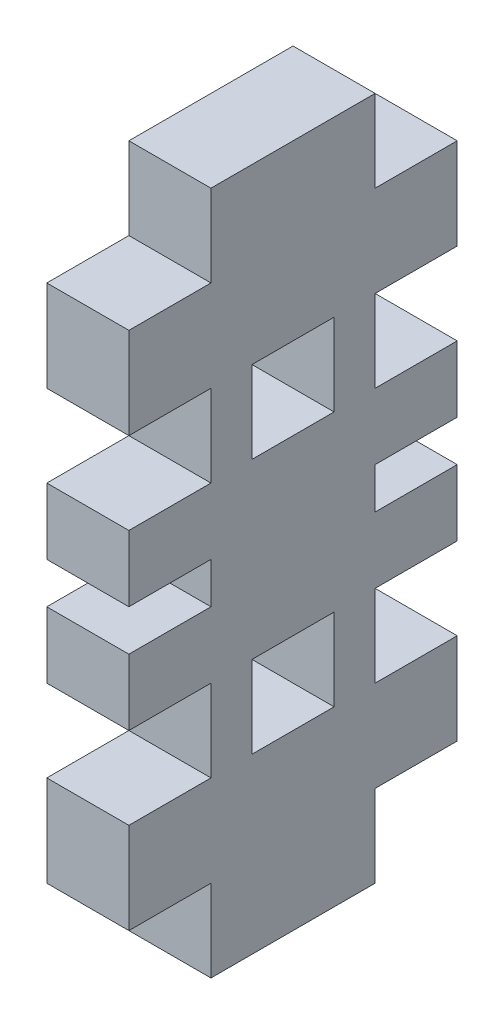
from build123d import *

# Parameters (mm, degrees)
SKETCH1_R                = 8
SKETCH1_R_2              = 4
BOSS_EXTRUDE1_DEPTH      = 9
BOSS_EXTRUDE1_2_DEPTH    = 9
SKETCH2_R                = 4
BOSS_EXTRUDE3_DEPTH      = 9
FILLET1_R                = 1
CUT_EXTRUDE1_DEPTH       = 214.789616212
SKETCH4_W                = 9
SKETCH4_H                = 27
BOSS_EXTRUDE4_DEPTH      = 75
BOSS_EXTRUDE5_START      = 9
SKETCH5_R                = 25
SKETCH5_R_2              = 4
BOSS_EXTRUDE5_DEPTH      = 9
BOSS_EXTRUDE6_DEPTH      = 4.5
BOSS_EXTRUDE6_DEPTH_BACK = 4.5
BOSS_EXTRUDE7_DEPTH      = 4.5
BOSS_EXTRUDE7_DEPTH_BACK = 4.5
BOSS_EXTRUDE7_START      = -25
SKETCH9_W                = 9
SKETCH9_H                = 7
SKETCH9_H_2              = 9
CUT_EXTRUDE2_DEPTH       = 217.612557346
CUT_EXTRUDE3_DEPTH       = 216.299790989
CUT_EXTRUDE3_DEPTH_BACK  = 216.299790989
SKETCH10_W               = 383.266903908
SKETCH10_H               = 66.559710411
SKETCH10_W_2             = 9
SKETCH10_H_2             = 36
SKETCH12_W               = 9
SKETCH12_H               = 9
SKETCH12_W_2             = 4.5
SKETCH12_H_2             = 9.054007778
SKETCH12_H_3             = 4.5
SKETCH12_H_4             = 5
CUT_EXTRUDE4_DEPTH       = 81.218451743


with BuildPart() as part:
    # Sketch1 → Boss-Extrude1 (new body)
    with BuildSketch(Plane.XY):
        with Locations((-125, 0)):
            Circle(SKETCH1_R)
        with Locations((-125, 0)):
            Circle(SKETCH1_R_2, mode=Mode.SUBTRACT)
    extrude(amount=BOSS_EXTRUDE1_DEPTH)



with BuildPart() as body_2:
    # Sketch1 → Boss-Extrude1 2 (new body)
    with BuildSketch(Plane.XY):
        with Locations((125, 0)):
            Circle(SKETCH1_R)
        with Locations((125, 0)):
            Circle(SKETCH1_R_2, mode=Mode.SUBTRACT)
    extrude(amount=BOSS_EXTRUDE1_2_DEPTH)


with BuildPart() as part_1:
    add(part.part)

    add(body_2.part)  # Boss-Extrude3 merges body 2
    # Sketch2 → Boss-Extrude3 (add)
    with BuildSketch(Plane.XY):
        with BuildLine():
            Line((-175, -75), (125, -75))
            ThreePointArc((125, -75), (130.131670325, -43.377223009), (145.000000492, -14.999999344))
            ThreePointArc((145.000000492, -14.999999344), (143.981414944, 16.269784471), (113.235294528, 22.058823748))
            ThreePointArc((113.235294528, 22.058823748), (25.000000075, 0), (-63.235294395, 22.058823677))
            ThreePointArc((-63.235294395, 22.058823677), (-75.420498385, 24.996463372), (-87.499999896, 21.650635154))
            ThreePointArc((-87.499999896, 21.650635154), (-99.999999954, 18.301270189), (-112.500000024, 21.650635108))
            ThreePointArc((-112.500000024, 21.650635108), (-124.99999995, 25), (-137.49999989, 21.650635158))
            ThreePointArc((-137.49999989, 21.650635158), (-149.999999954, 18.301270189), (-162.50000003, 21.650635112))
            ThreePointArc((-162.50000003, 21.650635112), (-193.705072901, 16.586749162), (-195.000000551, -14.999999265))
            ThreePointArc((-195.000000551, -14.999999265), (-180.13167034, -43.377222962), (-175, -75))
        make_face()
        with Locations((125, 0)):
            Circle(SKETCH2_R, mode=Mode.SUBTRACT)
        with Locations((-175, 0)):
            Circle(SKETCH2_R, mode=Mode.SUBTRACT)
        with Locations((-125, 0)):
            Circle(SKETCH2_R, mode=Mode.SUBTRACT)
        with Locations((-75, 0)):
            Circle(SKETCH2_R, mode=Mode.SUBTRACT)
    extrude(amount=BOSS_EXTRUDE3_DEPTH)

    # Fillet1
    fillet1_edges = [part_1.edges().sort_by_distance(p)[0] for p in [
        (-175, -75, 4.5),
        (125, -75, 4.5),
    ]]
    fillet(fillet1_edges, radius=FILLET1_R)

    # Sketch3 → Cut-Extrude1 (cut, through all)
    with BuildSketch(Plane.XY):
        Polygon((25, 0), (25, -75), (150, -75), (150, 25), (25, 25), align=None)
    extrude(amount=CUT_EXTRUDE1_DEPTH, mode=Mode.SUBTRACT)

    # Sketch4 → Boss-Extrude4 (add)
    with BuildSketch(Plane.XZ.offset(75)):
        with Locations((25, -4.5)):
            Rectangle(SKETCH4_W, SKETCH4_H)
    extrude(amount=-BOSS_EXTRUDE4_DEPTH)

    # Sketch5 → Boss-Extrude5 (add)
    # profile 1 of 4: a face of its own
    with BuildSketch(Plane(origin=(0, 0, -18), x_dir=(-1, 0, 0), z_dir=(0, 0, -1)).offset(BOSS_EXTRUDE5_START)):
        with BuildLine():
            ThreePointArc((-145.000000304, -14.999999594), (-130.131670275, -43.377223158), (-125, -75))
            Line((-125, -75), (-29.5, -75))
            Line((-29.5, -75), (-29.5, 0))
            Line((-29.5, 0), (-100, 0))
            ThreePointArc((-100, 0), (-117.09430609, -23.717082532), (-145.000000304, -14.999999594))
        make_face()
    # profile 2 of 4: a face of its own
    with BuildSketch(Plane(origin=(0, 0, -18), x_dir=(-1, 0, 0), z_dir=(0, 0, -1)).offset(BOSS_EXTRUDE5_START)):
        with Locations((-125, 0)):
            Circle(SKETCH5_R)
        with Locations((-125, 0)):
            Circle(SKETCH5_R_2, mode=Mode.SUBTRACT)
    # profile 3 of 4: a face of its own
    with BuildSketch(Plane(origin=(0, 0, -18), x_dir=(-1, 0, 0), z_dir=(0, 0, -1)).offset(BOSS_EXTRUDE5_START)):
        Polygon((-29.5, 0), (-29.5, -75), (-20.5, -75), (-20.5, 0), (-25, 0), align=None)
    # profile 4 of 4: a face of its own
    with BuildSketch(Plane(origin=(0, 0, -18), x_dir=(-1, 0, 0), z_dir=(0, 0, -1)).offset(BOSS_EXTRUDE5_START)):
        with BuildLine():
            Line((-100, 0), (-29.5, 0))
            Line((-29.5, 0), (-25, 0))
            ThreePointArc((-25, 0), (-70.475429529, 5.598281181), (-113.235293817, 22.058823369))
            ThreePointArc((-113.235293817, 22.058823369), (-103.56267677, 12.86239374), (-100, 0))
        make_face()
    extrude(amount=-BOSS_EXTRUDE5_DEPTH)

    # Sketch7 → Boss-Extrude6 (add, two sides: drawn at the far end of the back side and taken through both)
    with BuildSketch(Plane(origin=(0, -25, 0), x_dir=(1, 0, 0), z_dir=(0, 1, 0)).offset(-BOSS_EXTRUDE6_DEPTH_BACK)):
        with BuildLine():
            Line((56.5, 18), (29.5, 18))
            Line((29.5, 18), (29.5, -9))
            ThreePointArc((29.5, -9), (48.591883092, -1.091883092), (56.5, 18))
        make_face()
        with BuildLine():
            Line((-6.5, 0), (20.5, 0))
            Line((20.5, 0), (20.5, 27))
            ThreePointArc((20.5, 27), (1.408116908, 19.091883092), (-6.5, 0))
        make_face()
    extrude(amount=BOSS_EXTRUDE6_DEPTH + BOSS_EXTRUDE6_DEPTH_BACK)

    # Sketch7<3> → Boss-Extrude7 (add, two sides: drawn at the far end of the back side and taken through both)
    with BuildSketch(Plane(origin=(0, -25, 0), x_dir=(1, 0, 0), z_dir=(0, 1, 0)).offset(BOSS_EXTRUDE7_START - BOSS_EXTRUDE7_DEPTH_BACK)):
        with BuildLine():
            Line((56.5, 18), (29.5, 18))
            Line((29.5, 18), (29.5, -9))
            ThreePointArc((29.5, -9), (48.591883092, -1.091883092), (56.5, 18))
        make_face()
        with BuildLine():
            Line((-6.5, 0), (20.5, 0))
            Line((20.5, 0), (20.5, 27))
            ThreePointArc((20.5, 27), (1.408116908, 19.091883092), (-6.5, 0))
        make_face()
    extrude(amount=BOSS_EXTRUDE7_DEPTH + BOSS_EXTRUDE7_DEPTH_BACK)

    # Sketch9 → Cut-Extrude2 (cut, through all)
    with BuildSketch(Plane.XY.offset(9)):
        with Locations((-160.208548161, -53.5)):
            Rectangle(SKETCH9_W, SKETCH9_H)
        with Locations((-160.208548161, -70.5)):
            Rectangle(SKETCH9_W, SKETCH9_H_2)
        with Locations((-25.351798772, -53.5)):
            Rectangle(SKETCH9_W, SKETCH9_H)
        with Locations((-25.351798772, -70.5)):
            Rectangle(SKETCH9_W, SKETCH9_H_2)
        with Locations((109.504950616, -53.5)):
            Rectangle(SKETCH9_W, SKETCH9_H)
        with Locations((109.504950616, -70.5)):
            Rectangle(SKETCH9_W, SKETCH9_H_2)
    extrude(amount=-CUT_EXTRUDE2_DEPTH, mode=Mode.SUBTRACT)

    # Sketch10 → Cut-Extrude3 (cut, two sides: drawn at the far end of the back side and taken through both)
    with BuildSketch(Plane(origin=(0, 0, 0), x_dir=(1, 0, 0), z_dir=(0, 1, 0)).offset(-CUT_EXTRUDE3_DEPTH_BACK)):
        with Locations((-25.802694846, 3.514309581)):
            Rectangle(SKETCH10_W, SKETCH10_H)
        with Locations((25, 9)):
            Rectangle(SKETCH10_W_2, SKETCH10_H_2, mode=Mode.SUBTRACT)
    extrude(amount=CUT_EXTRUDE3_DEPTH + CUT_EXTRUDE3_DEPTH_BACK, mode=Mode.SUBTRACT)

    # Sketch12 → Cut-Extrude4 (cut, through all)
    with BuildSketch(Plane.ZY.offset(-20.5)):
        with Locations((-22.5, -23.5)):
            Rectangle(SKETCH12_W, SKETCH12_H)
        with Locations((-22.5, -51.5)):
            Rectangle(SKETCH12_W, SKETCH12_H)
        with Locations((4.5, -51.5)):
            Rectangle(SKETCH12_W, SKETCH12_H)
        with Locations((4.5, -23.5)):
            Rectangle(SKETCH12_W, SKETCH12_H)
        with Locations((-6.75, -23.5)):
            Rectangle(SKETCH12_W_2, SKETCH12_H)
        with Locations((-11.25, -23.5)):
            Rectangle(SKETCH12_W_2, SKETCH12_H)
        with Locations((-11.25, -51.5)):
            Rectangle(SKETCH12_W_2, SKETCH12_H)
        with Locations((-6.75, -51.5)):
            Rectangle(SKETCH12_W_2, SKETCH12_H)
        with Locations((-22.5, -4.5)):
            Rectangle(SKETCH12_W, SKETCH12_H)
        with Locations((4.5, -4.472996111)):
            Rectangle(SKETCH12_W, SKETCH12_H_2)
        with Locations((4.5, -70.5)):
            Rectangle(SKETCH12_W, SKETCH12_H)
        with Locations((-22.5, -70.5)):
            Rectangle(SKETCH12_W, SKETCH12_H)
        with Locations((-22.5, -37.5)):
            Rectangle(SKETCH12_W, SKETCH12_H_3)
        with Locations((4.5, -37.5)):
            Rectangle(SKETCH12_W, SKETCH12_H_3)
        with Locations((-22.5, 2.5)):
            Rectangle(SKETCH12_W, SKETCH12_H_4)
    extrude(amount=-CUT_EXTRUDE4_DEPTH, mode=Mode.SUBTRACT)


solid = part_1.part
